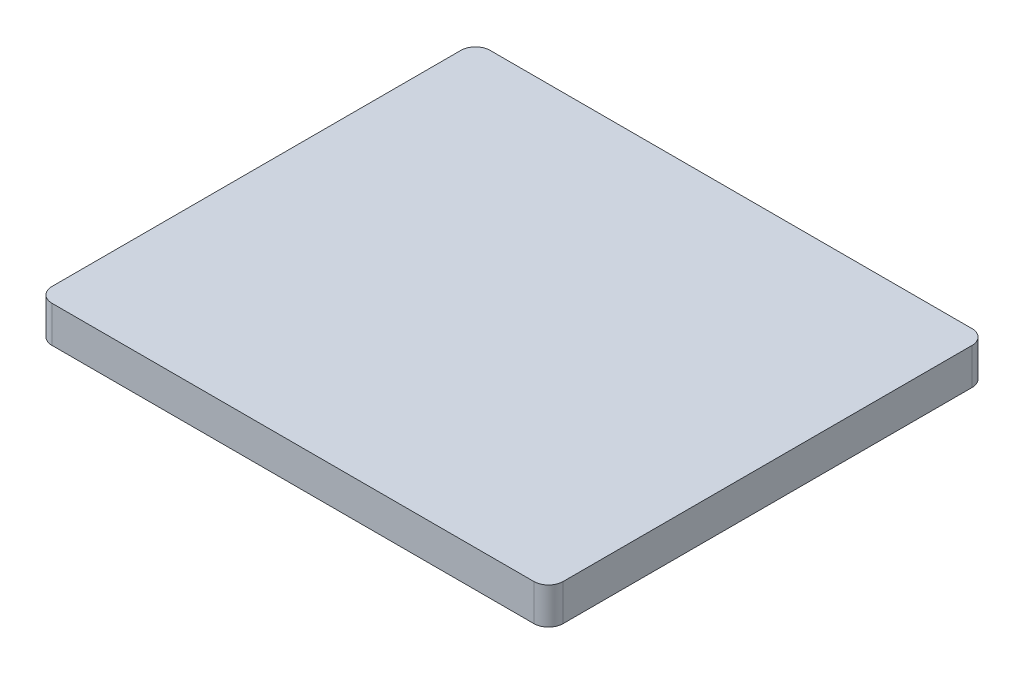
from build123d import *

# Parameters (mm, degrees)
SKETCH1_W            = 70
SKETCH1_H            = 60
BOSS_EXTRUDE2_DEPTH  = 5
SKETCH15_W           = 29
SKETCH15_H           = 9
BOSS_EXTRUDE13_DEPTH = 20
SKETCH16_R           = 5.5
CUT_EXTRUDE3_DEPTH   = 54.058929503
FILLET1_R            = 2


with BuildPart() as part:
    # Sketch1 → Boss-Extrude2 (new body)
    with BuildSketch(Plane(origin=(0, 0, 0), x_dir=(1, 0, 0), z_dir=(0, 1, 0))):
        Rectangle(SKETCH1_W, SKETCH1_H)
    extrude(amount=BOSS_EXTRUDE2_DEPTH)

    # Sketch15 → Boss-Extrude13 (add)
    with BuildSketch(Plane(origin=(0, 0, 0), x_dir=(-1, 0, 0), z_dir=(0, 1, 0))):
        Rectangle(SKETCH15_W, SKETCH15_H)
    extrude(amount=-BOSS_EXTRUDE13_DEPTH)

    # Sketch16 → Cut-Extrude3 (cut, through all)
    with BuildSketch(Plane.XY.offset(4.5)):
        with Locations((0, -12)):
            Circle(SKETCH16_R)
    extrude(amount=-CUT_EXTRUDE3_DEPTH, mode=Mode.SUBTRACT)

    # Fillet1
    fillet1_edges = [part.edges().sort_by_distance(p)[0] for p in [
        (0, 0, -4.5),
        (14.5, 0, 0),
        (-14.5, 0, 0),
        (-35, 2.5, 30),
        (35, 2.5, 30),
        (-35, 2.5, -30),
        (35, 2.5, -30),
        (0, -20, 4.5),
        (0, -20, -4.5),
        (14.5, -10, 4.5),
        (0, 0, 4.5),
        (14.5, -10, -4.5),
        (14.5, -20, 0),
        (-14.5, -20, 0),
        (-14.5, -10, -4.5),
        (-14.5, -10, 4.5),
    ]]
    fillet(fillet1_edges, radius=FILLET1_R)


solid = part.part
